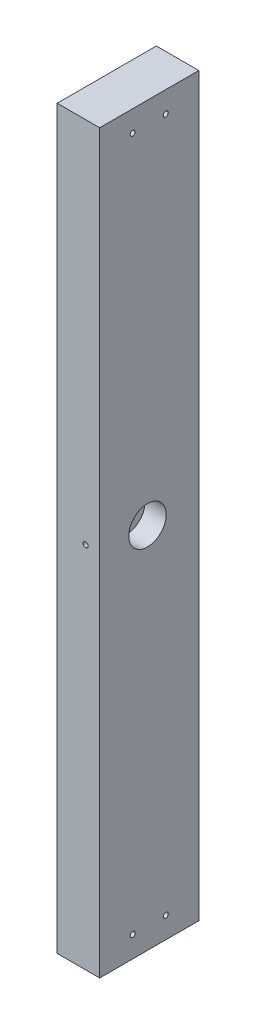
from build123d import *

# Parameters (mm, degrees)
SKETCH1_W               = 38.1
SKETCH1_H               = 88.9
BOSS_EXTRUDE1_DEPTH     = 660.4
SKETCH2_R               = 16.8275
CUT_EXTRUDE1_DEPTH      = 19.05
CUT_EXTRUDE2_REACH      = 669.445
CUT_EXTRUDE2_END_RADIUS = 16.8275
SKETCH3_R               = 2.2479
SKETCH4_R               = 2.2479
CUT_EXTRUDE3_DEPTH      = 668.445113848


with BuildPart() as part:
    # Sketch1 → Boss-Extrude1 (new body)
    with BuildSketch(Plane(origin=(0, 0, 0), x_dir=(1, 0, 0), z_dir=(0, 1, 0))):
        with Locations((19.05, 44.45)):
            Rectangle(SKETCH1_W, SKETCH1_H)
    extrude(amount=BOSS_EXTRUDE1_DEPTH)

    # Sketch2 → Cut-Extrude1 (cut)
    with BuildSketch(Plane(origin=(38.1, 0, 0), x_dir=(0, 0, -1), z_dir=(1, 0, 0))):
        with Locations((42.8752, 330.2)):
            Circle(SKETCH2_R)
    extrude(amount=-CUT_EXTRUDE1_DEPTH, mode=Mode.SUBTRACT)

    # Cut-Extrude2: up to this cylinder (the profile starts outside it)
    cut_extrude2_end = Plane(origin=(25.4, 330.2, -42.8752), z_dir=(1, 0, 0)) * Cylinder(CUT_EXTRUDE2_END_RADIUS, 1373.545, mode=Mode.PRIVATE)
    # Sketch3 → Cut-Extrude2 (cut, up to the surface)
    with BuildSketch(Plane.XY, mode=Mode.PRIVATE) as cut_extrude2_sk1:
        with Locations((25.4, 330.2)):
            Circle(SKETCH3_R)
    cut_extrude2_tool1 = extrude(cut_extrude2_sk1.sketch, amount=-CUT_EXTRUDE2_REACH, mode=Mode.PRIVATE) - cut_extrude2_end
    add(cut_extrude2_tool1.solids().sort_by_distance((25.4, 330.2, 0))[0], mode=Mode.SUBTRACT)

    # Sketch4 → Cut-Extrude3 (cut, through all)
    with BuildSketch(Plane(origin=(38.1, 0, 0), x_dir=(0, 0, -1), z_dir=(1, 0, 0))):
        with Locations((59.266666667, 19.05)):
            Circle(SKETCH4_R)
        with Locations((29.633333333, 19.05)):
            Circle(SKETCH4_R)
        with Locations((59.266666667, 641.35)):
            Circle(SKETCH4_R)
        with Locations((29.633333333, 641.35)):
            Circle(SKETCH4_R)
    extrude(amount=-CUT_EXTRUDE3_DEPTH, mode=Mode.SUBTRACT)


solid = part.part
